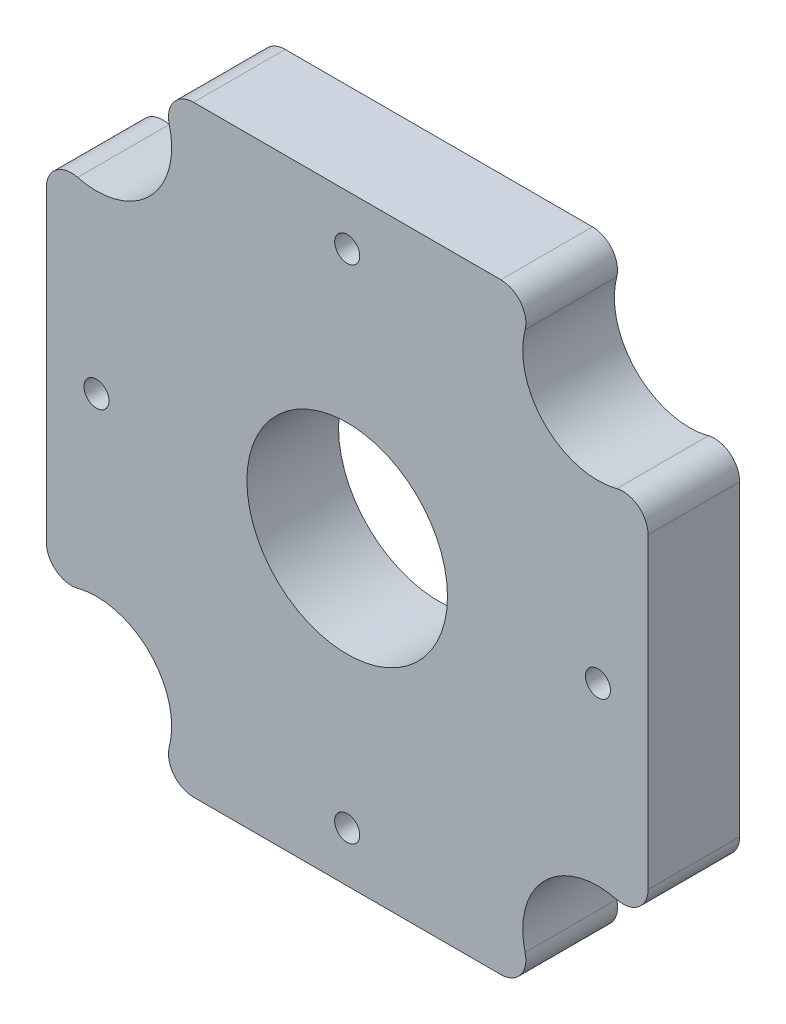
from build123d import *

# Parameters (mm, degrees)
BOSS_EXTRUDE1_DEPTH = 5.8
SKETCH2_R           = 0.79375
CUT_EXTRUDE1_DEPTH  = 28.558029683
SKETCH3_R           = 6.35
CUT_EXTRUDE2_DEPTH  = 12.7
FILLET1_R           = 1.5875


with BuildPart() as part:
    # Sketch1 → Boss-Extrude1 (new body)
    with BuildSketch(Plane.XY):
        with BuildLine():
            Line((12.325242086, 19.05), (-12.325242086, 19.05))
            ThreePointArc((-12.325242086, 19.05), (-12.507403955, 12.507403955), (-19.05, 12.325242086))
            Line((-19.05, 12.325242086), (-19.05, -12.325242086))
            ThreePointArc((-19.05, -12.325242086), (-12.507403955, -12.507403955), (-12.325242086, -19.05))
            Line((-12.325242086, -19.05), (12.325242086, -19.05))
            ThreePointArc((12.325242086, -19.05), (12.507403955, -12.507403955), (19.05, -12.325242086))
            Line((19.05, -12.325242086), (19.05, 12.325242086))
            ThreePointArc((19.05, 12.325242086), (12.507403955, 12.507403955), (12.325242086, 19.05))
        make_face()
    extrude(amount=BOSS_EXTRUDE1_DEPTH)

    # Sketch2 → Cut-Extrude1 (cut, through all)
    with BuildSketch(Plane.XY.offset(5.8)):
        with Locations((0, 15.875)):
            Circle(SKETCH2_R)
        with Locations((15.875, 0)):
            Circle(SKETCH2_R)
        with Locations((0, -15.875)):
            Circle(SKETCH2_R)
        with Locations((-15.875, 0)):
            Circle(SKETCH2_R)
    extrude(amount=-CUT_EXTRUDE1_DEPTH, mode=Mode.SUBTRACT)

    # Sketch3 → Cut-Extrude2 (cut)
    with BuildSketch(Plane.XY.offset(5.8)):
        Circle(SKETCH3_R)
    extrude(amount=-CUT_EXTRUDE2_DEPTH, mode=Mode.SUBTRACT)

    # Fillet1
    fillet1_edges = [part.edges().sort_by_distance(p)[0] for p in [
        (-12.325242086, 19.05, 2.9),
        (12.325242086, 19.05, 2.9),
        (19.05, 12.325242086, 2.9),
        (19.05, -12.325242086, 2.9),
        (12.325242086, -19.05, 2.9),
        (-12.325242086, -19.05, 2.9),
        (-19.05, -12.325242086, 2.9),
        (-19.05, 12.325242086, 2.9),
    ]]
    fillet(fillet1_edges, radius=FILLET1_R)


solid = part.part
